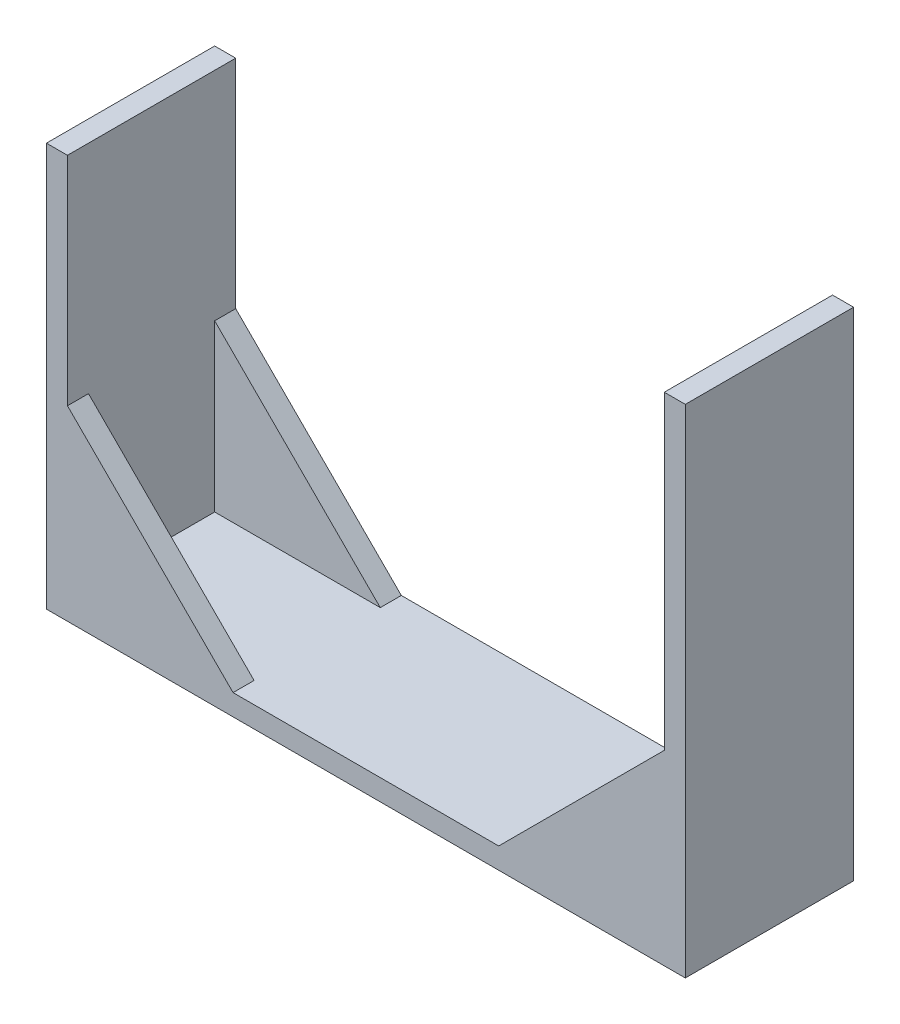
from build123d import *

# Parameters (mm, degrees)
BOSS_EXTRUDE1_DEPTH = 50.8
BOSS_EXTRUDE2_DEPTH = 12.7


with BuildPart() as part:
    # Sketch1 → Boss-Extrude1 (new, symmetric)
    with BuildSketch(Plane.XY):
        Polygon((0, 0), (385.8, 0), (385.8, 300), (373.1, 300), (373.1, 12.7), (12.7, 12.7), (12.7, 243.7), (0, 243.7), (0, 12.7), align=None)
    extrude(amount=BOSS_EXTRUDE1_DEPTH, both=True)

    # Sketch2 → Boss-Extrude2 (add)
    with BuildSketch(Plane.XY.offset(50.8)):
        Polygon((373.1, 112.7), (273.1, 12.7), (373.1, 12.7), align=None)
        Polygon((12.7, 12.7), (12.7, 112.7), (112.7, 12.7), align=None)
    boss_extrude2 = extrude(amount=-BOSS_EXTRUDE2_DEPTH)

    # Mirror1: Boss-Extrude2 across plane
    add(boss_extrude2.mirror(Plane.XY))


solid = part.part
